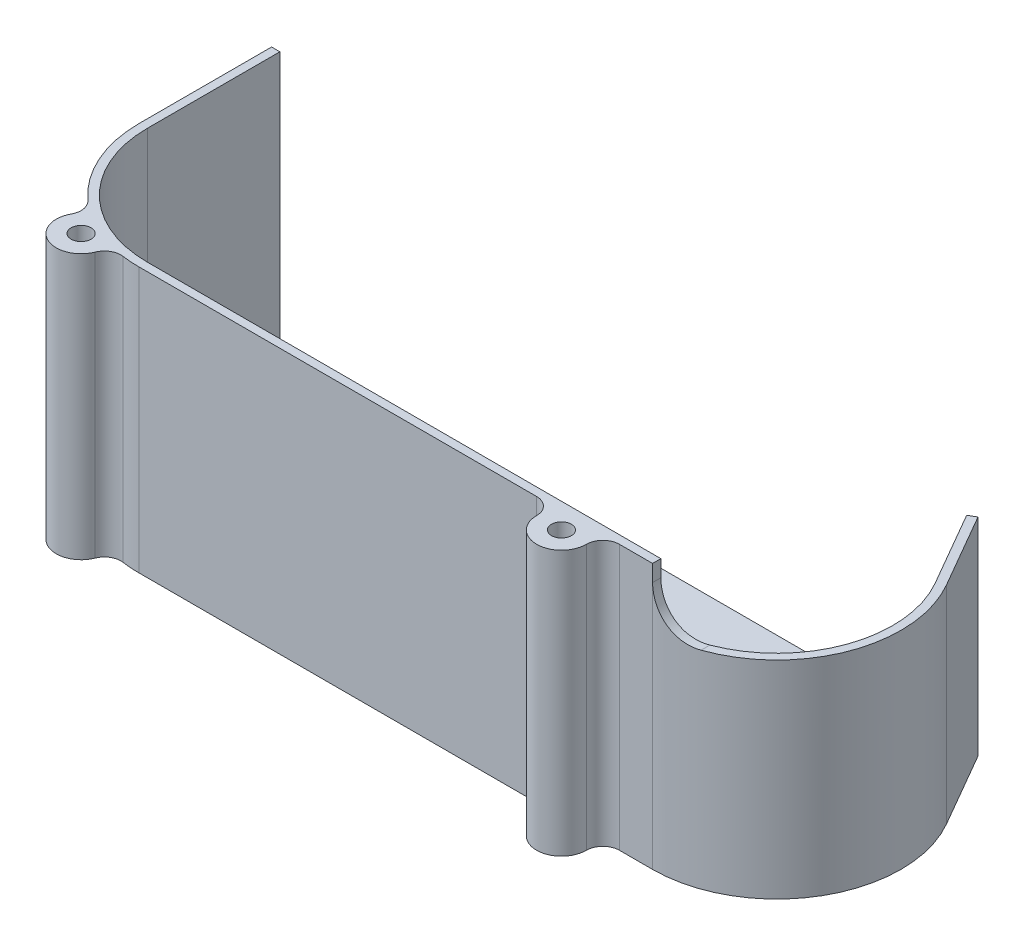
from build123d import *

# Parameters (mm, degrees)
EXTRU_MINCE1_DEPTH      = 32
BOSS_EXTRU_1_DEPTH      = 1
ESQUISSE3_R             = 1.2
BOSS_EXTRU_2_DEPTH      = 32
CONG_1_R                = 2
ENL_V_MAT_EXTRU_1_DEPTH = 83.37492882


with BuildPart() as part:
    # Esquisse1 → Extru.-Mince1 (new body)
    with BuildSketch(Plane(origin=(0, 0, 0), x_dir=(1, 0, 0), z_dir=(0, 1, 0))):
        with BuildLine():
            Line((-76, 30), (-76, 14))
            ThreePointArc((-76, 14), (-71.899494937, 4.100505063), (-62, 0))
            Line((-62, 0), (0, 0))
            ThreePointArc((0, 0), (12.124355653, 7), (12.124355653, 21))
            Line((12.124355653, 21), (6.92820323, 30))
            Line((6.92820323, 30), (7.794228634, 30.5))
            Line((7.794228634, 30.5), (12.990381057, 21.5))
            ThreePointArc((12.990381057, 21.5), (12.990381057, 6.5), (0, -1))
            Line((0, -1), (-62, -1))
            ThreePointArc((-62, -1), (-72.606601718, 3.393398282), (-77, 14))
            Line((-77, 14), (-77, 30))
            Line((-77, 30), (-76, 30))
        make_face()
    extrude(amount=EXTRU_MINCE1_DEPTH)

    # Esquisse2 → Boss.-Extru.1 (add)
    with BuildSketch(Plane(origin=(0, 0, 0), x_dir=(1, 0, 0), z_dir=(0, 1, 0))):
        with BuildLine():
            Line((-76, 30), (6.92820323, 30))
            Line((6.92820323, 30), (12.124355653, 21))
            ThreePointArc((12.124355653, 21), (12.124355653, 7), (0, 0))
            Line((0, 0), (-62, 0))
            ThreePointArc((-62, 0), (-71.899494937, 4.100505063), (-76, 14))
            Line((-76, 14), (-76, 30))
        make_face()
    extrude(amount=BOSS_EXTRU_1_DEPTH)

    # Esquisse3 → Boss.-Extru.2 (add)
    # profile 1 of 2: a face of its own
    with BuildSketch(Plane(origin=(0, 0, 0), x_dir=(1, 0, 0), z_dir=(0, 1, 0))):
        with BuildLine():
            Line((-11.236067977, -1), (-6.763932023, -1))
            ThreePointArc((-6.763932023, -1), (-9, -6), (-11.236067977, -1))
        make_face()
        with Locations(Location((-9, -3, 0), (0, 0, 270))):
            Circle(ESQUISSE3_R, mode=Mode.SUBTRACT)
    # profile 2 of 2: a face of its own
    with BuildSketch(Plane(origin=(0, 0, 0), x_dir=(1, 0, 0), z_dir=(0, 1, 0))):
        with BuildLine():
            ThreePointArc((-70.465946464, 1.617441683), (-70.268656396, -3.71854942), (-66.052301711, -0.442259201))
            ThreePointArc((-66.052301711, -0.442259201), (-68.34328198, 0.4072529), (-70.465946464, 1.617441683))
        make_face()
        with Locations(Location((-69, -1, 0), (0, 0, 270))):
            Circle(ESQUISSE3_R, mode=Mode.SUBTRACT)
    extrude(amount=BOSS_EXTRU_2_DEPTH)

    # Congé1
    cong_1_edges = [part.edges().sort_by_distance(p)[0] for p in [
        (-6.763932023, 16, 1),
        (-11.236067977, 16, 1),
        (-70.465946464, 16, -1.617441683),
        (-66.052301711, 16, 0.442259201),
    ]]
    fillet(cong_1_edges, radius=CONG_1_R)

    # Esquisse4 → Enlèv. mat.-Extru.1 (cut, through all)
    with BuildSketch(Plane(origin=(-7.939310229, 0, 1), x_dir=(-1, 0, 0), z_dir=(0, 0, -1))):
        with BuildLine():
            Line((-22.939310229, 32), (-7.939310229, 32))
            Line((-7.939310229, 32), (-7.939310229, 30))
            ThreePointArc((-7.939310229, 30), (-9.403776323, 26.464466094), (-12.939310229, 25))
            Line((-12.939310229, 25), (-22.939310229, 25))
            Line((-22.939310229, 25), (-22.939310229, 32))
        make_face()
    extrude(amount=ENL_V_MAT_EXTRU_1_DEPTH, mode=Mode.SUBTRACT)


solid = part.part
